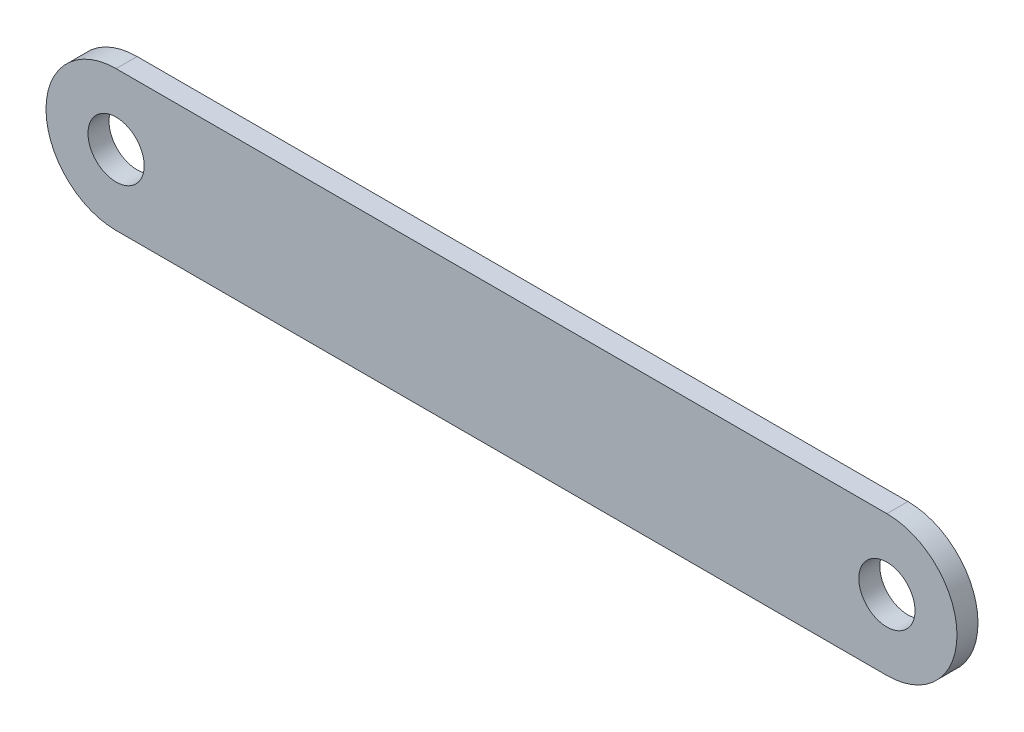
from build123d import *

# Parameters (mm, degrees)
SKETCH1_R           = 4.01
BOSS_EXTRUDE1_DEPTH = 3
SKETCH2_R           = 1.49
BOSS_EXTRUDE3_DEPTH = 4


with BuildPart() as part:
    # Sketch1 → Boss-Extrude1 (new body)
    with BuildSketch(Plane.XY):
        with BuildLine():
            Line((110, 10), (0, 10))
            ThreePointArc((0, 10), (-10, 0), (0, -10))
            Line((0, -10), (110, -10))
            ThreePointArc((110, -10), (120, 0), (110, 10))
        make_face()
        Circle(SKETCH1_R, mode=Mode.SUBTRACT)
        with Locations((110, 0)):
            Circle(SKETCH1_R, mode=Mode.SUBTRACT)
    extrude(amount=BOSS_EXTRUDE1_DEPTH)

    # Sketch2 → Boss-Extrude3 (add)
    with BuildSketch(Plane(origin=(0, 0, 0), x_dir=(-1, 0, 0), z_dir=(0, 0, -1))):
        with Locations(Location((-20, 0, 0), (0, 0, 180))):
            Circle(SKETCH2_R)
    extrude(amount=BOSS_EXTRUDE3_DEPTH)


solid = part.part
